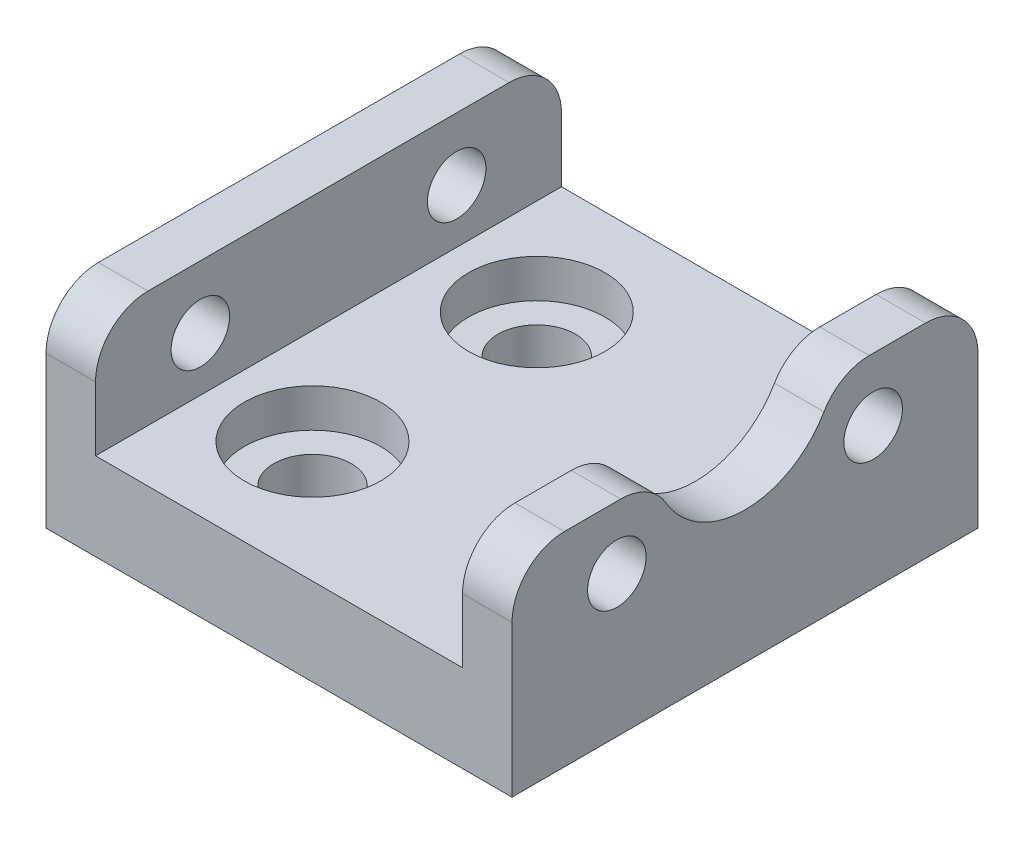
from build123d import *

# Parameters (mm, degrees)
SKETCH1_W                                        = 40.64
SKETCH1_H                                        = 40.64
BOSS_EXTRUDE1_DEPTH                              = 7.62
SKETCH2_W                                        = 4.318
SKETCH2_H                                        = 40.64
BOSS_EXTRUDE2_DEPTH                              = 10.16
F_10_CLEARANCE_HOLE1_D                           = 5.1054
CBORE_FOR_1_4_BUTTON_HEAD_CAP_SCREW1_D           = 6.7564
CBORE_FOR_1_4_BUTTON_HEAD_CAP_SCREW1_CBORE_D     = 11.90752
CBORE_FOR_1_4_BUTTON_HEAD_CAP_SCREW1_CBORE_DEPTH = 3.3528
CUT_EXTRUDE1_REACH                               = 62.161
SKETCH8_R                                        = 7.965368028
FILLET1_R                                        = 4.572


with BuildPart() as part:
    # Sketch1 → Boss-Extrude1 (new body)
    with BuildSketch(Plane(origin=(0, 0, 0), x_dir=(1, 0, 0), z_dir=(0, 1, 0))):
        with Locations((20.32, -20.32)):
            Rectangle(SKETCH1_W, SKETCH1_H)
    extrude(amount=BOSS_EXTRUDE1_DEPTH)

    # Sketch2 → Boss-Extrude2 (add)
    with BuildSketch(Plane(origin=(0, 7.62, 0), x_dir=(1, 0, 0), z_dir=(0, 1, 0))):
        with Locations((2.159, -20.32)):
            Rectangle(SKETCH2_W, SKETCH2_H)
        with Locations((38.481, -20.32)):
            Rectangle(SKETCH2_W, SKETCH2_H)
    extrude(amount=BOSS_EXTRUDE2_DEPTH)

    # #10 Clearance Hole1 (through all)
    with Locations(Plane.ZY):
        with Locations((9.144, 12.319), (31.496, 12.319)):
            Hole(F_10_CLEARANCE_HOLE1_D / 2)

    # CBORE for 1/4 Button Head Cap Screw1 (through all)
    with Locations(Plane(origin=(0, 7.62, 0), x_dir=(1, 0, 0), z_dir=(0, 1, 0))):
        with Locations((12.7, -10.541), (12.7, -30.099)):
            CounterBoreHole(CBORE_FOR_1_4_BUTTON_HEAD_CAP_SCREW1_D / 2, CBORE_FOR_1_4_BUTTON_HEAD_CAP_SCREW1_CBORE_D / 2, CBORE_FOR_1_4_BUTTON_HEAD_CAP_SCREW1_CBORE_DEPTH)

    # Sketch8 → Cut-Extrude1 (cut, up to next)
    with BuildSketch(Plane(origin=(40.64, 0, 0), x_dir=(0, 0, -1), z_dir=(1, 0, 0)), mode=Mode.PRIVATE) as cut_extrude1_sk1:
        with Locations((-20.32, 19.504553012)):
            Circle(SKETCH8_R)
    cut_extrude1_tool1 = extrude(cut_extrude1_sk1.sketch, amount=-CUT_EXTRUDE1_REACH, mode=Mode.PRIVATE) & part.part
    add(cut_extrude1_tool1.solids().sort_by_distance((40.64, 19.504553, 20.32))[0], mode=Mode.SUBTRACT)

    # Fillet1
    fillet1_edges = [part.edges().sort_by_distance(p)[0] for p in [
        (38.481, 17.78, 28.096439078),
        (38.481, 17.78, 12.543560922),
        (38.481, 17.78, 0),
        (38.481, 17.78, 40.64),
        (2.159, 17.78, 0),
        (2.159, 17.78, 40.64),
    ]]
    fillet(fillet1_edges, radius=FILLET1_R)


solid = part.part
